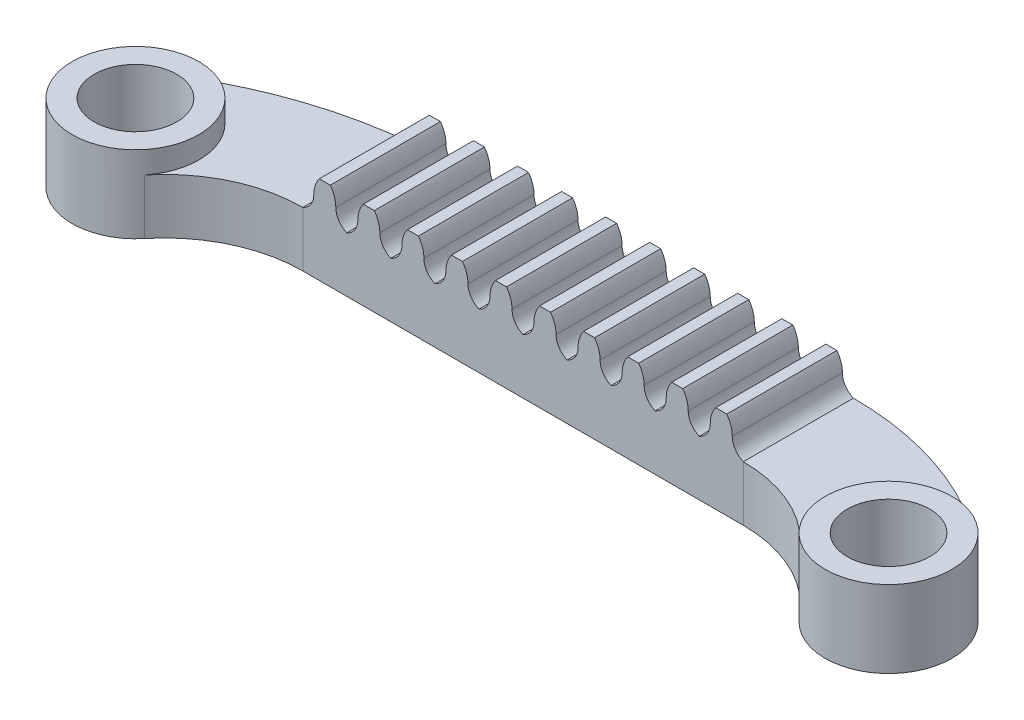
from build123d import *

# Parameters (mm, degrees)
SKETCH1_R                       = 3.75
BOSS_EXTRUDE1_DEPTH             = 5
BOSS_EXTRUDE2_REACH             = 43.932
SKETCH2_W                       = 1
SKETCH2_H                       = 1.5
BOSS_EXTRUDE2_DIRECTION_2_REACH = 43.932
LPATTERN1_COUNT                 = 10
LPATTERN1_PITCH                 = 4
SKETCH1_3_R                     = 5.75
SKETCH1_3_R_2                   = 3.75
BOSS_EXTRUDE3_DEPTH             = 7


with BuildPart() as part:
    # Sketch1 → Boss-Extrude1 (new body)
    with BuildSketch(Plane(origin=(0, 0, 0), x_dir=(1, 0, 0), z_dir=(0, 1, 0))):
        with BuildLine():
            ThreePointArc((-37.419913953, -1.242883661), (-38.427487159, -9.886669857), (-29.729020754, -9.627969703))
            ThreePointArc((-29.729020754, -9.627969703), (-25.386834609, -6.215943245), (-20, -5))
            Line((-20, -5), (20, -5))
            ThreePointArc((20, -5), (25.386834609, -6.215943245), (29.729020754, -9.627969703))
            ThreePointArc((29.729020754, -9.627969703), (38.202781159, -10.118262664), (37.932471123, -1.634635193))
            ThreePointArc((37.932471123, -1.634635193), (29.560228877, 3.288161479), (20, 5))
            Line((20, 5), (-20, 5))
            ThreePointArc((-20, 5), (-29.105909857, 2.983410588), (-37.419913953, -1.242883661))
        make_face()
        with Locations(Location((-34.19, -6, 0), (0, 0, 270))):
            Circle(SKETCH1_R, mode=Mode.SUBTRACT)
        with Locations(Location((34.19, -6, 0), (0, 0, 270))):
            Circle(SKETCH1_R, mode=Mode.SUBTRACT)
    extrude(amount=BOSS_EXTRUDE1_DEPTH)

    # Boss-Extrude2: up to this face of the body (flat: up to its plane)
    boss_extrude2_end = Plane(part.part.faces().sort_by_distance((0, 2.5, 5))[0])
    # Sketch2 → Boss-Extrude2 (add, up to the picked face)
    with BuildSketch(Plane.XY, mode=Mode.PRIVATE) as boss_extrude2_sk1:
        with BuildLine():
            ThreePointArc((-19, 6.5), (-19.272918272, 5.598612181), (-20, 5))
            Line((-20, 5), (-18, 5))
            Line((-18, 5), (-18, 6.5))
            Line((-18, 6.5), (-19, 6.5))
        make_face()
    boss_extrude2_tool1 = split(extrude(boss_extrude2_sk1.sketch, amount=BOSS_EXTRUDE2_REACH, mode=Mode.PRIVATE), bisect_by=boss_extrude2_end, keep=Keep.BOTH, mode=Mode.PRIVATE)
    # Sketch2 → Boss-Extrude2 (add, up to the picked face)
    with BuildSketch(Plane.XY, mode=Mode.PRIVATE) as boss_extrude2_sk2:
        with Locations((-17.5, 5.75)):
            Rectangle(SKETCH2_W, SKETCH2_H)
    boss_extrude2_tool2 = split(extrude(boss_extrude2_sk2.sketch, amount=BOSS_EXTRUDE2_REACH, mode=Mode.PRIVATE), bisect_by=boss_extrude2_end, keep=Keep.BOTH, mode=Mode.PRIVATE)
    # Sketch2 → Boss-Extrude2 (add, up to the picked face)
    with BuildSketch(Plane.XY, mode=Mode.PRIVATE) as boss_extrude2_sk3:
        with BuildLine():
            Line((-17, 6.5), (-17, 5))
            Line((-17, 5), (-16, 5))
            ThreePointArc((-16, 5), (-16.727081728, 5.598612181), (-17, 6.5))
        make_face()
    boss_extrude2_tool3 = split(extrude(boss_extrude2_sk3.sketch, amount=BOSS_EXTRUDE2_REACH, mode=Mode.PRIVATE), bisect_by=boss_extrude2_end, keep=Keep.BOTH, mode=Mode.PRIVATE)
    # Sketch2 → Boss-Extrude2 (add, up to the picked face)
    with BuildSketch(Plane.XY, mode=Mode.PRIVATE) as boss_extrude2_sk4:
        with BuildLine():
            Line((-18, 8), (-18, 6.5))
            Line((-18, 6.5), (-17, 6.5))
            ThreePointArc((-17, 6.5), (-17.128291755, 7.290569415), (-17.5, 8))
            Line((-17.5, 8), (-18, 8))
        make_face()
    boss_extrude2_tool4 = split(extrude(boss_extrude2_sk4.sketch, amount=BOSS_EXTRUDE2_REACH, mode=Mode.PRIVATE), bisect_by=boss_extrude2_end, keep=Keep.BOTH, mode=Mode.PRIVATE)
    # Sketch2 → Boss-Extrude2 (add, up to the picked face)
    with BuildSketch(Plane.XY, mode=Mode.PRIVATE) as boss_extrude2_sk5:
        with BuildLine():
            ThreePointArc((-18.5, 8), (-18.871708245, 7.290569415), (-19, 6.5))
            Line((-19, 6.5), (-18, 6.5))
            Line((-18, 6.5), (-18, 8))
            Line((-18, 8), (-18.5, 8))
        make_face()
    boss_extrude2_tool5 = split(extrude(boss_extrude2_sk5.sketch, amount=BOSS_EXTRUDE2_REACH, mode=Mode.PRIVATE), bisect_by=boss_extrude2_end, keep=Keep.BOTH, mode=Mode.PRIVATE)
    boss_extrude2_1 = boss_extrude2_tool1.solids().sort_by(Axis((-18.667854, 5.662777, 0), (0, 0, 1)))[0]
    add(boss_extrude2_1)
    boss_extrude2_2 = boss_extrude2_tool2.solids().sort_by(Axis((-17.5, 5.75, 0), (0, 0, 1)))[0]
    add(boss_extrude2_2)
    boss_extrude2_3 = boss_extrude2_tool3.solids().sort_by(Axis((-16.726983, 5.348311, 0), (0, 0, 1)))[0]
    add(boss_extrude2_3)
    boss_extrude2_4 = boss_extrude2_tool4.solids().sort_by(Axis((-17.56692, 7.177404, 0), (0, 0, 1)))[0]
    add(boss_extrude2_4)
    boss_extrude2_5 = boss_extrude2_tool5.solids().sort_by(Axis((-18.43308, 7.177404, 0), (0, 0, 1)))[0]
    add(boss_extrude2_5)
    boss_extrude2 = boss_extrude2_1 + boss_extrude2_2 + boss_extrude2_3 + boss_extrude2_4 + boss_extrude2_5  # Boss-Extrude2 as one shape, for the pattern or mirror that repeats it

    # Boss-Extrude2 direction 2: up to this face of the body (flat: up to its plane)
    boss_extrude2_direction_2_end = Plane(part.part.faces().sort_by_distance((0, 2.5, -5))[0])
    # Sketch2 → Boss-Extrude2 direction 2 (add, up to the picked face)
    with BuildSketch(Plane.XY, mode=Mode.PRIVATE) as boss_extrude2_direction_2_sk1:
        with BuildLine():
            ThreePointArc((-19, 6.5), (-19.272918272, 5.598612181), (-20, 5))
            Line((-20, 5), (-18, 5))
            Line((-18, 5), (-18, 6.5))
            Line((-18, 6.5), (-19, 6.5))
        make_face()
    boss_extrude2_direction_2_tool1 = split(extrude(boss_extrude2_direction_2_sk1.sketch, amount=-BOSS_EXTRUDE2_DIRECTION_2_REACH, mode=Mode.PRIVATE), bisect_by=boss_extrude2_direction_2_end, keep=Keep.BOTH, mode=Mode.PRIVATE)
    # Sketch2 → Boss-Extrude2 direction 2 (add, up to the picked face)
    with BuildSketch(Plane.XY, mode=Mode.PRIVATE) as boss_extrude2_direction_2_sk2:
        with Locations((-17.5, 5.75)):
            Rectangle(SKETCH2_W, SKETCH2_H)
    boss_extrude2_direction_2_tool2 = split(extrude(boss_extrude2_direction_2_sk2.sketch, amount=-BOSS_EXTRUDE2_DIRECTION_2_REACH, mode=Mode.PRIVATE), bisect_by=boss_extrude2_direction_2_end, keep=Keep.BOTH, mode=Mode.PRIVATE)
    # Sketch2 → Boss-Extrude2 direction 2 (add, up to the picked face)
    with BuildSketch(Plane.XY, mode=Mode.PRIVATE) as boss_extrude2_direction_2_sk3:
        with BuildLine():
            Line((-17, 6.5), (-17, 5))
            Line((-17, 5), (-16, 5))
            ThreePointArc((-16, 5), (-16.727081728, 5.598612181), (-17, 6.5))
        make_face()
    boss_extrude2_direction_2_tool3 = split(extrude(boss_extrude2_direction_2_sk3.sketch, amount=-BOSS_EXTRUDE2_DIRECTION_2_REACH, mode=Mode.PRIVATE), bisect_by=boss_extrude2_direction_2_end, keep=Keep.BOTH, mode=Mode.PRIVATE)
    # Sketch2 → Boss-Extrude2 direction 2 (add, up to the picked face)
    with BuildSketch(Plane.XY, mode=Mode.PRIVATE) as boss_extrude2_direction_2_sk4:
        with BuildLine():
            Line((-18, 8), (-18, 6.5))
            Line((-18, 6.5), (-17, 6.5))
            ThreePointArc((-17, 6.5), (-17.128291755, 7.290569415), (-17.5, 8))
            Line((-17.5, 8), (-18, 8))
        make_face()
    boss_extrude2_direction_2_tool4 = split(extrude(boss_extrude2_direction_2_sk4.sketch, amount=-BOSS_EXTRUDE2_DIRECTION_2_REACH, mode=Mode.PRIVATE), bisect_by=boss_extrude2_direction_2_end, keep=Keep.BOTH, mode=Mode.PRIVATE)
    # Sketch2 → Boss-Extrude2 direction 2 (add, up to the picked face)
    with BuildSketch(Plane.XY, mode=Mode.PRIVATE) as boss_extrude2_direction_2_sk5:
        with BuildLine():
            ThreePointArc((-18.5, 8), (-18.871708245, 7.290569415), (-19, 6.5))
            Line((-19, 6.5), (-18, 6.5))
            Line((-18, 6.5), (-18, 8))
            Line((-18, 8), (-18.5, 8))
        make_face()
    boss_extrude2_direction_2_tool5 = split(extrude(boss_extrude2_direction_2_sk5.sketch, amount=-BOSS_EXTRUDE2_DIRECTION_2_REACH, mode=Mode.PRIVATE), bisect_by=boss_extrude2_direction_2_end, keep=Keep.BOTH, mode=Mode.PRIVATE)
    boss_extrude2_direction_2_1 = boss_extrude2_direction_2_tool1.solids().sort_by(Axis((-18.667854, 5.662777, 0), (0, 0, -1)))[0]
    add(boss_extrude2_direction_2_1)
    boss_extrude2_direction_2_2 = boss_extrude2_direction_2_tool2.solids().sort_by(Axis((-17.5, 5.75, 0), (0, 0, -1)))[0]
    add(boss_extrude2_direction_2_2)
    boss_extrude2_direction_2_3 = boss_extrude2_direction_2_tool3.solids().sort_by(Axis((-16.726983, 5.348311, 0), (0, 0, -1)))[0]
    add(boss_extrude2_direction_2_3)
    boss_extrude2_direction_2_4 = boss_extrude2_direction_2_tool4.solids().sort_by(Axis((-17.56692, 7.177404, 0), (0, 0, -1)))[0]
    add(boss_extrude2_direction_2_4)
    boss_extrude2_direction_2_5 = boss_extrude2_direction_2_tool5.solids().sort_by(Axis((-18.43308, 7.177404, 0), (0, 0, -1)))[0]
    add(boss_extrude2_direction_2_5)
    boss_extrude2_direction_2 = boss_extrude2_direction_2_1 + boss_extrude2_direction_2_2 + boss_extrude2_direction_2_3 + boss_extrude2_direction_2_4 + boss_extrude2_direction_2_5  # Boss-Extrude2 direction 2 as one shape, for the pattern or mirror that repeats it

    # LPattern1: Boss-Extrude2, Boss-Extrude2 direction 2 ×10
    with Locations(*[(i * LPATTERN1_PITCH, 0, 0) for i in range(1, LPATTERN1_COUNT)]):
        add(boss_extrude2)
        add(boss_extrude2_direction_2)

    # Sketch1<3> → Boss-Extrude3 (add)
    # profile 1 of 2: a face of its own
    with BuildSketch(Plane(origin=(0, 0, 0), x_dir=(1, 0, 0), z_dir=(0, 1, 0))):
        with Locations(Location((-34.19, -6, 0), (0, 0, 124.175119346))):
            Circle(SKETCH1_3_R)
        with Locations(Location((-34.19, -6, 0), (0, 0, 270))):
            Circle(SKETCH1_3_R_2, mode=Mode.SUBTRACT)
    # profile 2 of 2: a face of its own
    with BuildSketch(Plane(origin=(0, 0, 0), x_dir=(1, 0, 0), z_dir=(0, 1, 0))):
        with Locations(Location((34.19, -6, 0), (0, 0, 49.393183525))):
            Circle(SKETCH1_3_R)
        with Locations(Location((34.19, -6, 0), (0, 0, 270))):
            Circle(SKETCH1_3_R_2, mode=Mode.SUBTRACT)
    extrude(amount=BOSS_EXTRUDE3_DEPTH)


solid = part.part
